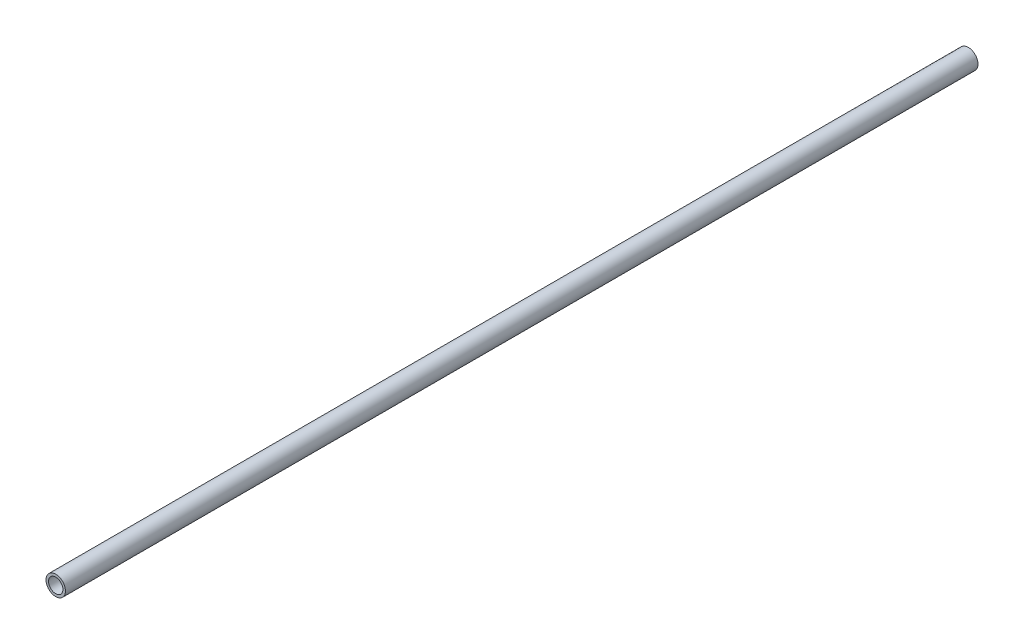
from build123d import *

# Parameters (mm, degrees)
SKETCH1_R           = 10.668
SKETCH1_R_2         = 7.8994
EXTRUDE_THIN1_DEPTH = 500


with BuildPart() as part:
    # Sketch1 → Extrude-Thin1 (new, symmetric)
    with BuildSketch(Plane.XY):
        Circle(SKETCH1_R)
        Circle(SKETCH1_R_2, mode=Mode.SUBTRACT)
    extrude(amount=EXTRUDE_THIN1_DEPTH, both=True)


solid = part.part
